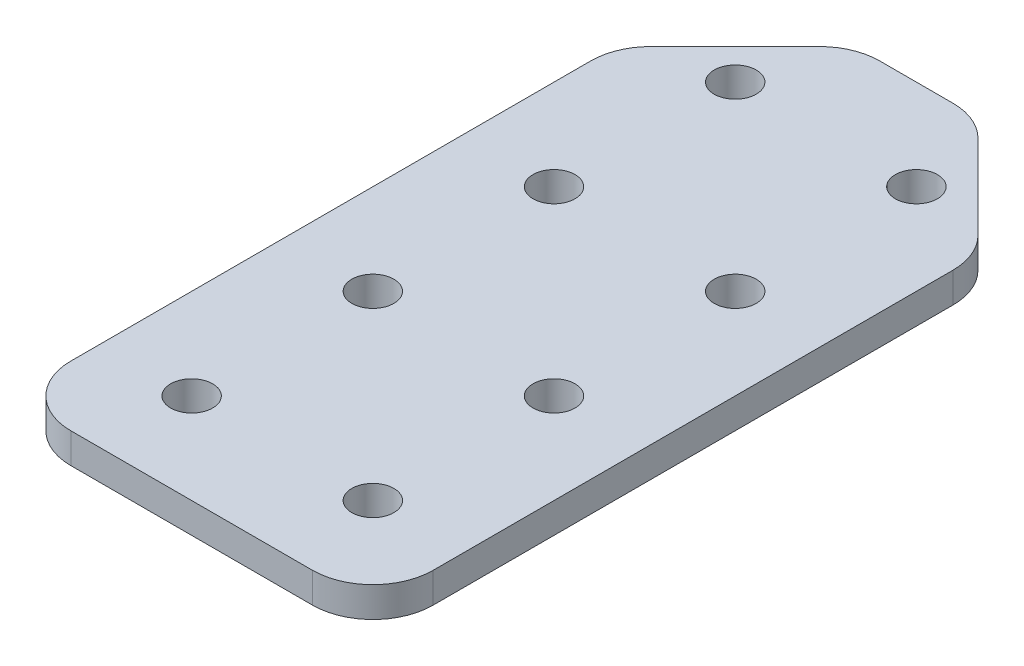
from build123d import *

# Parameters (mm, degrees)
SKETCH1_W           = 76.2
SKETCH1_H           = 152.4
BOSS_EXTRUDE1_DEPTH = 3.175
SKETCH2_R           = 4.4196
CUT_EXTRUDE1_DEPTH  = 86.430512699
CUT_EXTRUDE2_DEPTH  = 86.430512699
FILLET1_R           = 12.7


with BuildPart() as part:
    # Sketch1 → Boss-Extrude1 (new, symmetric)
    with BuildSketch(Plane(origin=(0, 0, 0), x_dir=(1, 0, 0), z_dir=(0, 1, 0))):
        Rectangle(SKETCH1_W, SKETCH1_H)
    extrude(amount=BOSS_EXTRUDE1_DEPTH, both=True)

    # Sketch2 → Cut-Extrude1 (cut, through all)
    with BuildSketch(Plane(origin=(0, 3.175, 0), x_dir=(1, 0, 0), z_dir=(0, 1, 0))):
        with Locations(Location((-19.05, 57.15, 0), (0, 0, 270))):
            Circle(SKETCH2_R)
        with Locations(Location((19.05, 57.15, 0), (0, 0, 270))):
            Circle(SKETCH2_R)
        with Locations(Location((19.05, 19.05, 0), (0, 0, 270))):
            Circle(SKETCH2_R)
        with Locations(Location((19.05, -19.05, 0), (0, 0, 270))):
            Circle(SKETCH2_R)
        with Locations(Location((19.05, -57.15, 0), (0, 0, 270))):
            Circle(SKETCH2_R)
        with Locations(Location((-19.05, 19.05, 0), (0, 0, 270))):
            Circle(SKETCH2_R)
        with Locations(Location((-19.05, -19.05, 0), (0, 0, 270))):
            Circle(SKETCH2_R)
        with Locations(Location((-19.05, -57.15, 0), (0, 0, 270))):
            Circle(SKETCH2_R)
    extrude(amount=-CUT_EXTRUDE1_DEPTH, mode=Mode.SUBTRACT)

    # Sketch3 → Cut-Extrude2 (cut, through all)
    with BuildSketch(Plane(origin=(0, 3.175, 0), x_dir=(1, 0, 0), z_dir=(0, 1, 0))):
        Polygon((-38.1, 51.055282861), (-12.955282861, 76.2), (-38.1, 76.2), align=None)
        Polygon((12.955282861, 76.2), (38.1, 76.2), (38.1, 51.055282861), align=None)
    extrude(amount=-CUT_EXTRUDE2_DEPTH, mode=Mode.SUBTRACT)

    # Fillet1
    fillet1_edges = [part.edges().sort_by_distance(p)[0] for p in [
        (-38.1, 0, -51.055282861),
        (-12.955282861, 0, -76.2),
        (38.1, 0, -51.055282861),
        (12.955282861, 0, -76.2),
        (38.1, 0, 76.2),
        (-38.1, 0, 76.2),
    ]]
    fillet(fillet1_edges, radius=FILLET1_R)


solid = part.part
